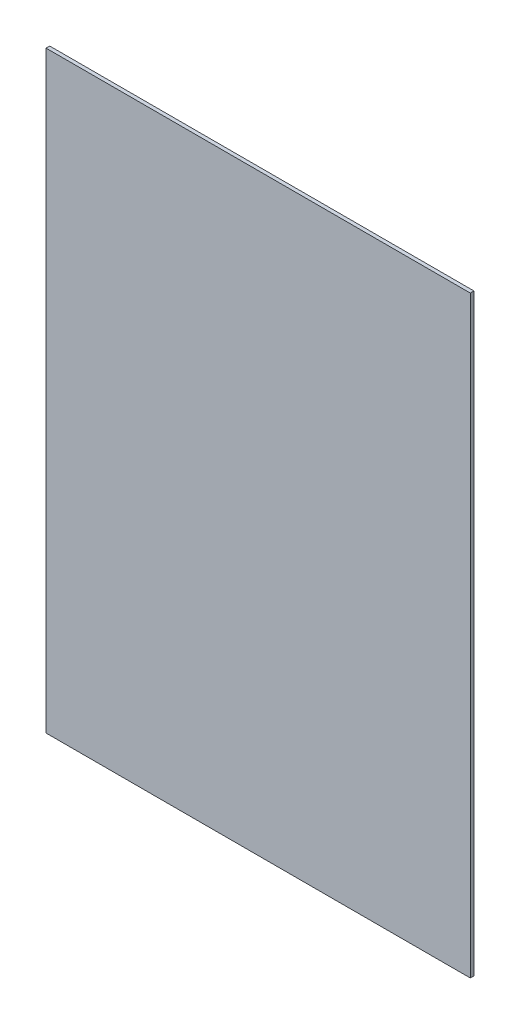
from build123d import *

# Parameters (mm, degrees)
SKETCH1_W           = 127.3
SKETCH1_H           = 178
BOSS_EXTRUDE1_DEPTH = 1.1


with BuildPart() as part:
    # Sketch1 → Boss-Extrude1 (new body)
    with BuildSketch(Plane.XY):
        with Locations((0, 89)):
            Rectangle(SKETCH1_W, SKETCH1_H)
    extrude(amount=BOSS_EXTRUDE1_DEPTH)


solid = part.part
